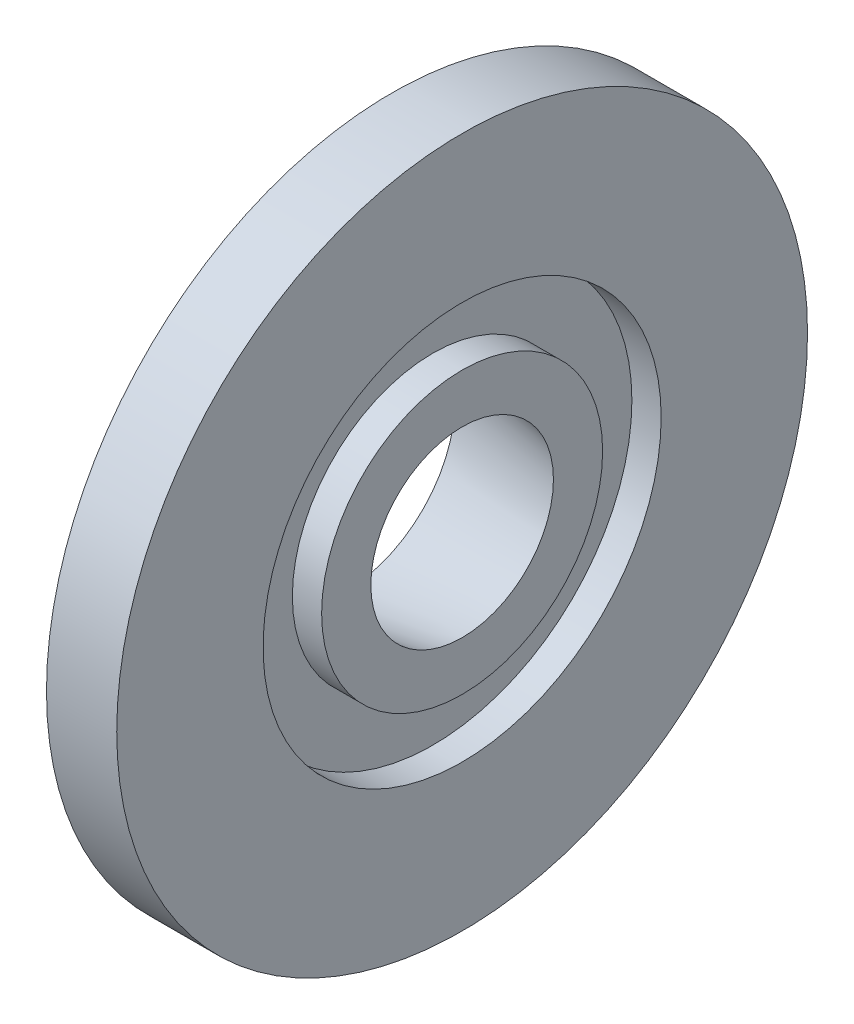
from build123d import *


with BuildPart() as part:
    # Sketch1 → Revolve1 (revolve)
    with BuildSketch(Plane.XY, mode=Mode.PRIVATE) as revolve1_sk:
        Polygon((-2.54, 8.636), (-2.54, 14.986), (-5.588, 14.986), (-7.62, 7.402472759), (-7.62, 0), (-2.54, 0), (-2.54, 6.096), (-3.81, 6.096), (-3.81, 8.636), align=None)
    revolve(revolve1_sk.sketch.rotate(Axis((-12.512764007, 0, 0), (-1, 0, 0)), 90), axis=Axis((-12.512764007, 0, 0), (-1, 0, 0)))

    # Sketch2 → Cut-Revolve1 (revolve, cut)
    with BuildSketch(Plane.XY, mode=Mode.PRIVATE) as cut_revolve1_sk:
        Polygon((-9.728542139, 0), (0.013390026, 0), (0.013390026, 3.553074477), (-9.728542139, 5.111363938), align=None)
    revolve(cut_revolve1_sk.sketch.rotate(Axis((-9.728542139, 0, 0), (-1, 0, 0)), 270), axis=Axis((-9.728542139, 0, 0), (-1, 0, 0)), mode=Mode.SUBTRACT)


solid = part.part
